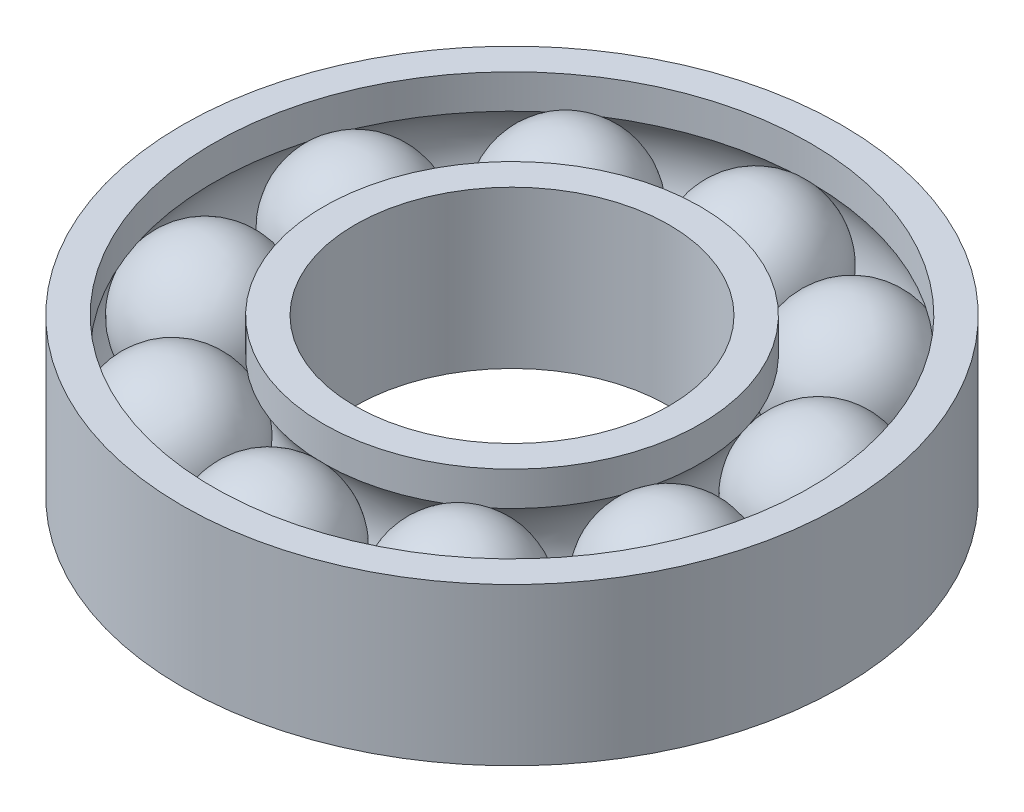
from build123d import *

# Parameters (mm, degrees)
CIRPATTERN2_COUNT = 10


with BuildPart() as part:
    # Sketch2 → Revolve1 (revolve)
    with BuildSketch(Plane(origin=(0, 0, 0), x_dir=(0, 0, -1), z_dir=(1, 0, 0))):
        with BuildLine():
            Line((55, 0), (100, 0))
            ThreePointArc((100, 0), (77.5, 22.5), (55, 0))
        make_face()
    revolve(axis=Axis((0, 0, -55), (0, 0, -1)))


with BuildPart() as body_2:
    # Sketch1 → Revolve2 (revolve)
    with BuildSketch(Plane(origin=(0, 0, 0), x_dir=(0, 0, -1), z_dir=(1, 0, 0))):
        with BuildLine():
            ThreePointArc((60, 14.142135624), (55, 0), (60, -14.142135624))
            Line((60, -14.142135624), (60, -25))
            Line((60, -25), (50, -25))
            Line((50, -25), (50, 25))
            Line((50, 25), (60, 25))
            Line((60, 25), (60, 14.142135624))
        make_face()
        with BuildLine():
            ThreePointArc((95, -14.142135624), (100, 0), (95, 14.142135624))
            Line((95, 14.142135624), (95, 25))
            Line((95, 25), (105, 25))
            Line((105, 25), (105, -25))
            Line((105, -25), (95, -25))
            Line((95, -25), (95, -14.142135624))
        make_face()
    revolve(axis=Axis((0, -25, 0), (0, 1, 0)))


with BuildPart() as cirpattern2_1:
    # CirPattern2: pattern copy
    add(part.part.rotate(Axis((0, 0, 0), (0, 1, 0)), 1 * 360 / CIRPATTERN2_COUNT))


with BuildPart() as cirpattern2_2:
    # CirPattern2: pattern copy
    add(part.part.rotate(Axis((0, 0, 0), (0, 1, 0)), 2 * 360 / CIRPATTERN2_COUNT))


with BuildPart() as cirpattern2_3:
    # CirPattern2: pattern copy
    add(part.part.rotate(Axis((0, 0, 0), (0, 1, 0)), 3 * 360 / CIRPATTERN2_COUNT))


with BuildPart() as cirpattern2_4:
    # CirPattern2: pattern copy
    add(part.part.rotate(Axis((0, 0, 0), (0, 1, 0)), 4 * 360 / CIRPATTERN2_COUNT))


with BuildPart() as cirpattern2_5:
    # CirPattern2: pattern copy
    add(part.part.rotate(Axis((0, 0, 0), (0, 1, 0)), 5 * 360 / CIRPATTERN2_COUNT))


with BuildPart() as cirpattern2_6:
    # CirPattern2: pattern copy
    add(part.part.rotate(Axis((0, 0, 0), (0, 1, 0)), 6 * 360 / CIRPATTERN2_COUNT))


with BuildPart() as cirpattern2_7:
    # CirPattern2: pattern copy
    add(part.part.rotate(Axis((0, 0, 0), (0, 1, 0)), 7 * 360 / CIRPATTERN2_COUNT))


with BuildPart() as cirpattern2_8:
    # CirPattern2: pattern copy
    add(part.part.rotate(Axis((0, 0, 0), (0, 1, 0)), 8 * 360 / CIRPATTERN2_COUNT))


with BuildPart() as cirpattern2_9:
    # CirPattern2: pattern copy
    add(part.part.rotate(Axis((0, 0, 0), (0, 1, 0)), 9 * 360 / CIRPATTERN2_COUNT))


solid = Compound([part.part, body_2.part, cirpattern2_1.part, cirpattern2_2.part, cirpattern2_3.part, cirpattern2_4.part, cirpattern2_5.part, cirpattern2_6.part, cirpattern2_7.part, cirpattern2_8.part, cirpattern2_9.part])
